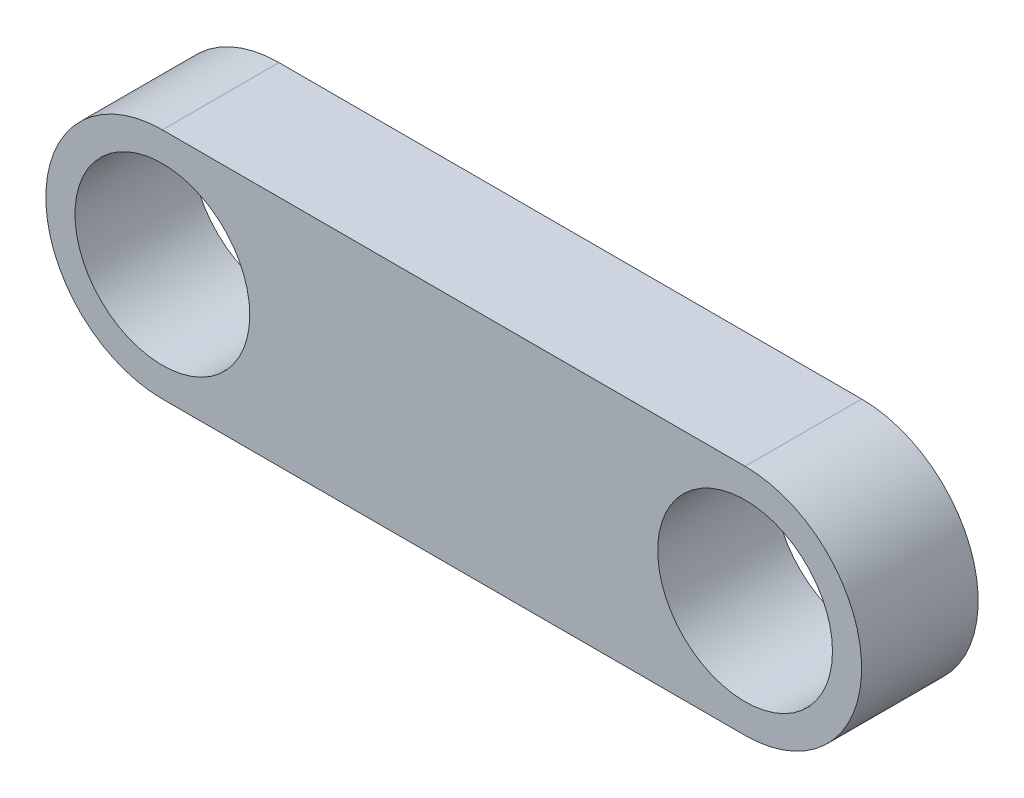
from build123d import *

# Parameters (mm, degrees)
SKETCH1_R           = 1.5
BOSS_EXTRUDE1_DEPTH = 2


with BuildPart() as part:
    # Sketch1 → Boss-Extrude1 (new body)
    with BuildSketch(Plane.XY):
        with BuildLine():
            Line((-15.465155122, -13.341113756), (-5.465155122, -13.341113756))
            ThreePointArc((-5.465155122, -13.341113756), (-3.465155122, -11.341113756), (-5.465155122, -9.341113756))
            Line((-5.465155122, -9.341113756), (-15.465155122, -9.341113756))
            ThreePointArc((-15.465155122, -9.341113756), (-17.465155122, -11.341113756), (-15.465155122, -13.341113756))
        make_face()
        with Locations((-15.465155122, -11.341113756)):
            Circle(SKETCH1_R, mode=Mode.SUBTRACT)
        with Locations((-5.465155122, -11.341113756)):
            Circle(SKETCH1_R, mode=Mode.SUBTRACT)
    extrude(amount=BOSS_EXTRUDE1_DEPTH)


solid = part.part
